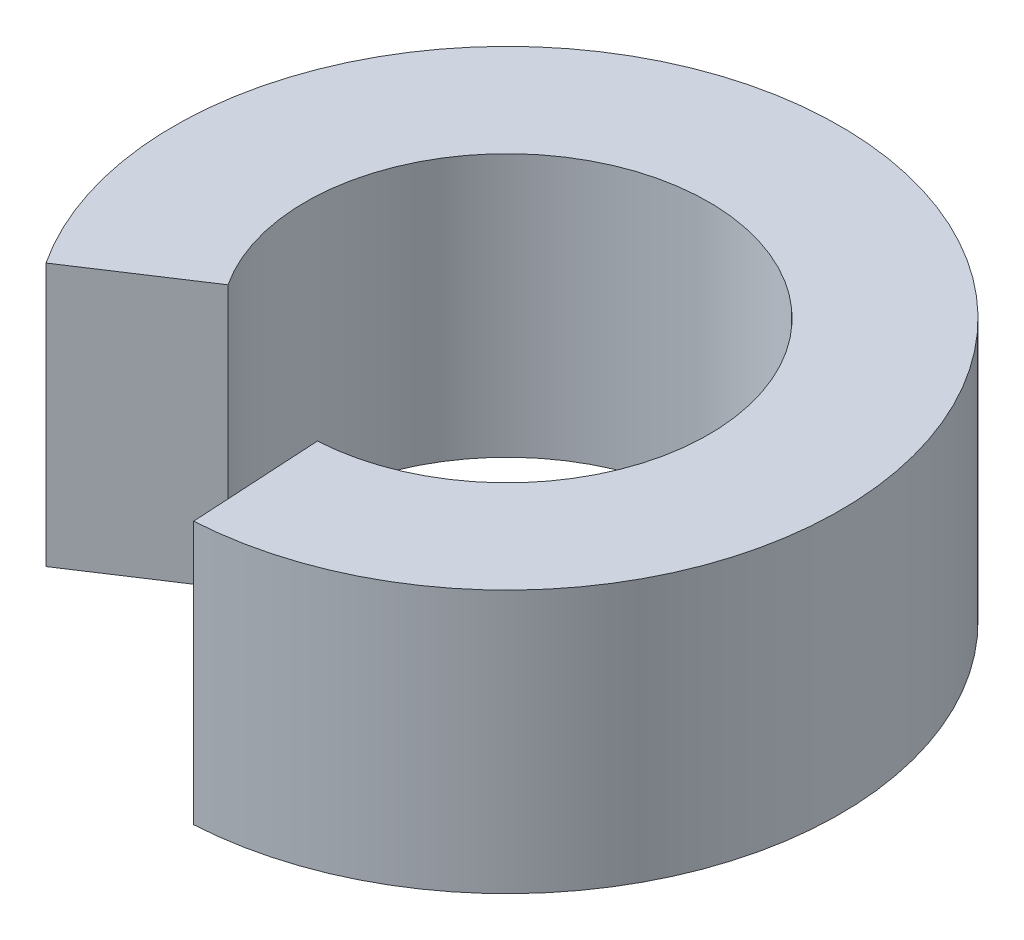
from build123d import *

# Parameters (mm, degrees)
BOSS_EXTRUDE1_DEPTH = 3


with BuildPart() as part:
    # Sketch3 → Boss-Extrude1 (new body)
    with BuildSketch(Plane(origin=(0, 0, 0), x_dir=(1, 0, 0), z_dir=(0, 1, 0))):
        with BuildLine():
            Line((-1.922910195, -1.261909815), (-3.176982061, -2.084894478))
            ThreePointArc((-3.176982061, -2.084894478), (1.708899934, 3.394062612), (0.217080551, -3.793794411))
            Line((0.217080551, -3.793794411), (0.13139086, -2.296243986))
            ThreePointArc((0.13139086, -2.296243986), (1.03433417, 2.054301055), (-1.922910195, -1.261909815))
        make_face()
    extrude(amount=BOSS_EXTRUDE1_DEPTH)


solid = part.part
